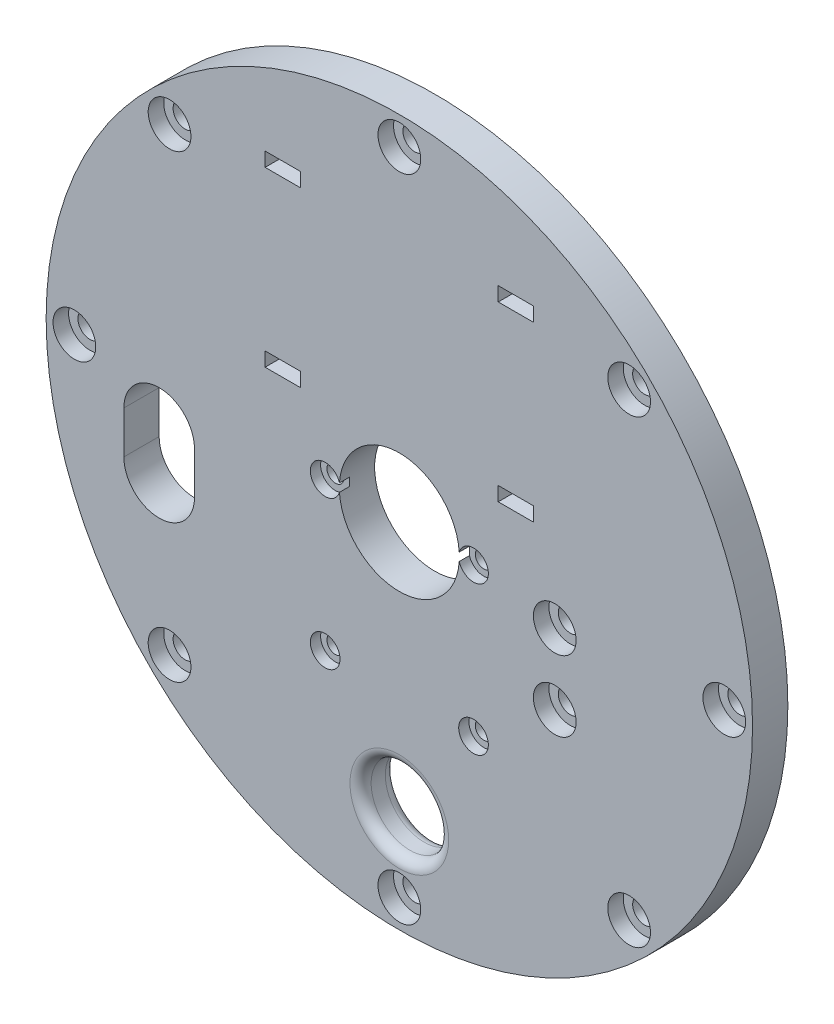
from build123d import *

# Parameters (mm, degrees)
SKETCH_1_R                   = 50
EXTRUDE_1_DEPTH              = 5
HOLE_WIZARD_M2_1_D           = 2.4
HOLE_WIZARD_M2_1_CBORE_D     = 4.2
HOLE_WIZARD_M2_1_CBORE_DEPTH = 1.45
HOLE_WIZARD_M3_2_D           = 3.4
HOLE_WIZARD_M3_2_CBORE_D     = 6.05
HOLE_WIZARD_M3_2_CBORE_DEPTH = 2.2
PATTERN_CIRCULAR_1_COUNT     = 8
SKETCH_6_R                   = 8.5
CUT_EXTRUDE_1_DEPTH          = 71.887234394
SKETCH_7_R                   = 5.4875
CUT_EXTRUDE_2_DEPTH          = 71.887234394
FILLET_1_R                   = 1.5
HOLE_WIZARD_M3_3_D           = 3.4
HOLE_WIZARD_M3_3_CBORE_D     = 6.05
HOLE_WIZARD_M3_3_CBORE_DEPTH = 2.2
SKETCH_12_W                  = 5
SKETCH_12_H                  = 2
CUT_EXTRUDE_4_DEPTH          = 71.887234394
SKETCH_14_W                  = 2
SKETCH_14_H                  = 5
EXTRUDE_2_DEPTH              = 3
FILLET_2_R                   = 1
FILLET_2_OF_MIRROR_2_R       = 1
CUT_EXTRUDE_5_DEPTH          = 72.161787499


with BuildPart() as part:
    # ｽｹｯﾁ1 → ﾎﾞｽ - 押し出し1 (new body)
    with BuildSketch(Plane.XY):
        Circle(SKETCH_1_R)
    extrude(amount=EXTRUDE_1_DEPTH)

    # M2 丸平ねじ用座ぐり穴1 (through all)
    with Locations(Plane.XY.offset(5)):
        with Locations((-10.5, 0), (-10.5, -21)):
            hole_wizard_m2_1 = CounterBoreHole(HOLE_WIZARD_M2_1_D / 2, HOLE_WIZARD_M2_1_CBORE_D / 2, HOLE_WIZARD_M2_1_CBORE_DEPTH)

    # ﾐﾗｰ1: M2 丸平ねじ用座ぐり穴1 across plane
    add(hole_wizard_m2_1.mirror(Plane(origin=(0, 0, 0), x_dir=(0, 0, 1), z_dir=(1, 0, 0))), mode=Mode.SUBTRACT)

    # M3 丸平ねじ用座ぐり穴2 (through all)
    with Locations(Plane.XY.offset(5)):
        with Locations((46, 0)):
            hole_wizard_m3_2 = CounterBoreHole(HOLE_WIZARD_M3_2_D / 2, HOLE_WIZARD_M3_2_CBORE_D / 2, HOLE_WIZARD_M3_2_CBORE_DEPTH)

    # 円形ﾊﾟﾀｰﾝ1: M3 丸平ねじ用座ぐり穴2 ×8 about axis
    pattern_circular_1_axis = Axis((0, 0, 0), (0, 0, 1))
    for i in range(1, PATTERN_CIRCULAR_1_COUNT):
        add(hole_wizard_m3_2.rotate(pattern_circular_1_axis, i * 360 / PATTERN_CIRCULAR_1_COUNT), mode=Mode.SUBTRACT)

    # ｽｹｯﾁ6 → ｶｯﾄ - 押し出し1 (cut, through all)
    with BuildSketch(Plane.XY.offset(5)):
        Circle(SKETCH_6_R)
    extrude(amount=-CUT_EXTRUDE_1_DEPTH, mode=Mode.SUBTRACT)

    # ｽｹｯﾁ7 → ｶｯﾄ - 押し出し2 (cut, through all)
    with BuildSketch(Plane.XY.offset(5)):
        with Locations((0, -35.4875)):
            Circle(SKETCH_7_R)
    extrude(amount=-CUT_EXTRUDE_2_DEPTH, mode=Mode.SUBTRACT)

    # ﾌｨﾚｯﾄ1
    fillet_1_edges = [part.edges().sort_by_distance(p)[0] for p in [
        (-5.4875, -35.4875, 0),
        (-5.4875, -35.4875, 5),
    ]]
    fillet(fillet_1_edges, radius=FILLET_1_R)

    # M3 丸平ねじ用座ぐり穴3 (through all)
    with Locations(Plane.XY.offset(5)):
        with Locations((22, -2), (22, -12)):
            CounterBoreHole(HOLE_WIZARD_M3_3_D / 2, HOLE_WIZARD_M3_3_CBORE_D / 2, HOLE_WIZARD_M3_3_CBORE_DEPTH)

    # ｽｹｯﾁ12 → ｶｯﾄ - 押し出し4 (cut, through all)
    with BuildSketch(Plane(origin=(0, 0, 0), x_dir=(-1, 0, 0), z_dir=(0, 0, -1))):
        with Locations((16.5, 35)):
            Rectangle(SKETCH_12_W, SKETCH_12_H)
        with Locations((16.5, 10.5)):
            Rectangle(SKETCH_12_W, SKETCH_12_H)
    cut_extrude_4 = extrude(amount=-CUT_EXTRUDE_4_DEPTH, mode=Mode.SUBTRACT)

    # ｽｹｯﾁ14 → ﾎﾞｽ - 押し出し2 (add)
    with BuildSketch(Plane(origin=(0, 0, 0), x_dir=(-1, 0, 0), z_dir=(0, 0, -1))):
        with Locations((25, 29.5)):
            Rectangle(SKETCH_14_W, SKETCH_14_H)
        with Locations((25, 16)):
            Rectangle(SKETCH_14_W, SKETCH_14_H)
    extrude_2 = extrude(amount=EXTRUDE_2_DEPTH)

    # ﾌｨﾚｯﾄ2
    fillet_2_edges = [part.edges().sort_by_distance(p)[0] for p in [
        (-26, 29.5, 0),
        (-26, 16, 0),
    ]]
    fillet(fillet_2_edges, radius=FILLET_2_R)

    # ﾐﾗｰ2: ｶｯﾄ - 押し出し4, ﾎﾞｽ - 押し出し2 across plane
    add(cut_extrude_4.mirror(Plane(origin=(0, 0, 0), x_dir=(0, 0, 1), z_dir=(1, 0, 0))), mode=Mode.SUBTRACT)
    add(extrude_2.mirror(Plane(origin=(0, 0, 0), x_dir=(0, 0, 1), z_dir=(1, 0, 0))))

    # ﾌｨﾚｯﾄ2 of ﾐﾗｰ2
    fillet_2_of_mirror_2_edges = [part.edges().sort_by_distance(p)[0] for p in [
        (26, 29.5, 0),
        (26, 16, 0),
    ]]
    fillet(fillet_2_of_mirror_2_edges, radius=FILLET_2_OF_MIRROR_2_R)

    # ｽｹｯﾁ15 → ｶｯﾄ - 押し出し5 (cut, through all)
    with BuildSketch(Plane.XY.offset(5)):
        with BuildLine():
            Line((-29, -5.5), (-29, -11.5))
            ThreePointArc((-29, -11.5), (-34, -16.5), (-39, -11.5))
            Line((-39, -11.5), (-39, -5.5))
            ThreePointArc((-39, -5.5), (-34, -0.5), (-29, -5.5))
        make_face()
    extrude(amount=-CUT_EXTRUDE_5_DEPTH, mode=Mode.SUBTRACT)


solid = part.part
